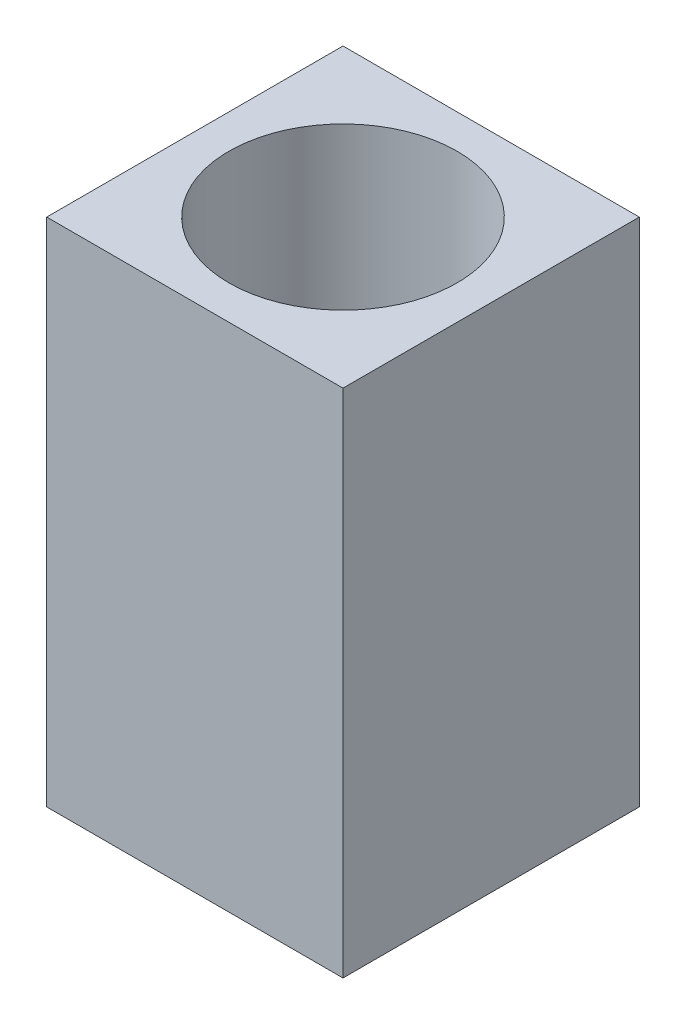
from build123d import *

# Parameters (mm, degrees)
SKETCH1_W           = 34.8
SKETCH1_H           = 34.8
SKETCH1_R           = 13.4
BOSS_EXTRUDE1_DEPTH = 60


with BuildPart() as part:
    # Sketch1 → Boss-Extrude1 (new body)
    with BuildSketch(Plane(origin=(0, 0, 0), x_dir=(1, 0, 0), z_dir=(0, 1, 0))):
        Rectangle(SKETCH1_W, SKETCH1_H)
        with Locations(Location((0, 0, 0), (0, 0, 270))):
            Circle(SKETCH1_R, mode=Mode.SUBTRACT)
    boss_extrude1 = extrude(amount=BOSS_EXTRUDE1_DEPTH)


with BuildPart() as mirror2_1:
    # Mirror2: Boss-Extrude1 across Right Plane
    add(boss_extrude1.mirror(Plane(origin=(0, 0, 0), x_dir=(0, 0, -1), z_dir=(1, 0, 0))))


with BuildPart() as part_1:
    add(part.part)

    # Mirror2 united with what the copies touc: union Mirror2_1
    add(mirror2_1.part)


solid = part_1.part
